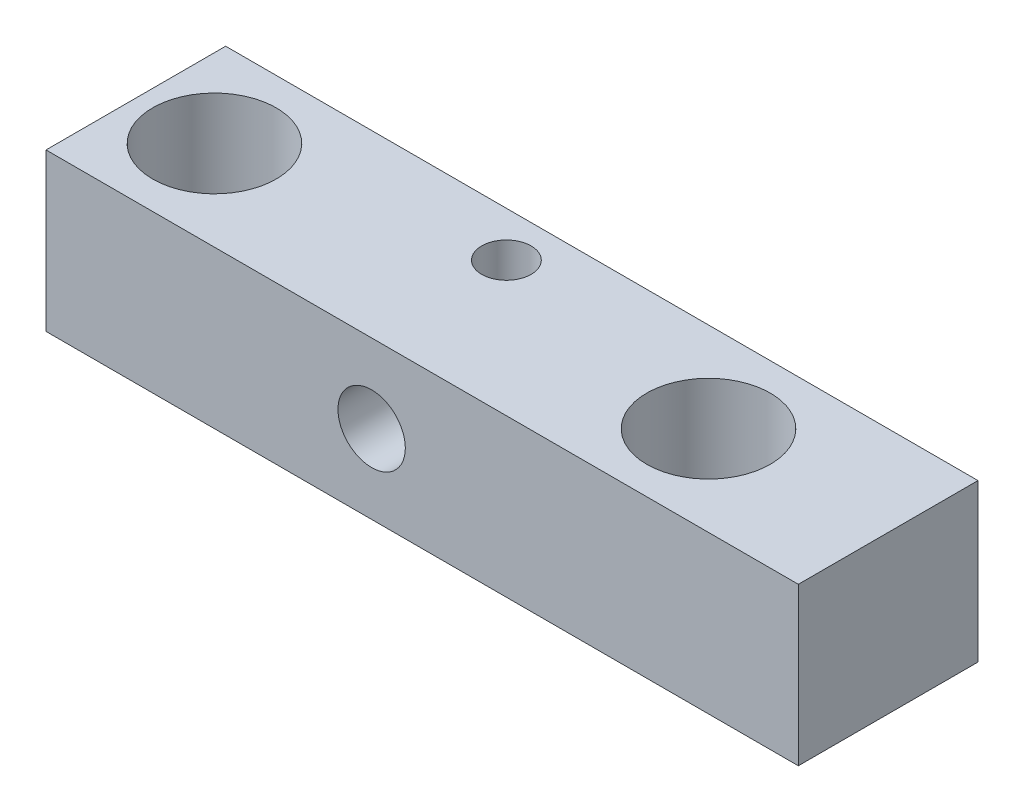
from build123d import *

# Parameters (mm, degrees)
SKETCH_1_W          = 38
SKETCH_1_H          = 8
SKETCH_1_R          = 2.75
SKETCH_1_R_2        = 1.1
EXTRUDE_1_DEPTH     = 7
SKETCH_2_W          = 4.5
SKETCH_2_H          = 7
CUT_EXTRUDE_1_DEPTH = 27.617640313
SKETCH_4_R          = 1.5
CUT_EXTRUDE_2_DEPTH = 6


with BuildPart() as part:
    # 草图1 → 凸台-拉伸1 (new body)
    with BuildSketch(Plane(origin=(0, 0, 0), x_dir=(1, 0, 0), z_dir=(0, 1, 0))):
        with Locations((5.402843602, 4.239336493)):
            Rectangle(SKETCH_1_W, SKETCH_1_H)
        with Locations(Location((-5.597156398, 4.239336493, 0), (0, 0, 270))):
            Circle(SKETCH_1_R, mode=Mode.SUBTRACT)
        with Locations(Location((16.402843602, 4.239336493, 0), (0, 0, 270))):
            Circle(SKETCH_1_R, mode=Mode.SUBTRACT)
        with Locations(Location((5.402843602, 6.239336493, 0), (0, 0, 270))):
            Circle(SKETCH_1_R_2, mode=Mode.SUBTRACT)
    extrude(amount=EXTRUDE_1_DEPTH)

    # 草图2 → 切除-拉伸1 (cut, through all)
    with BuildSketch(Plane.XY.offset(-0.239336493)):
        with Locations((-11.347156398, 3.5)):
            Rectangle(SKETCH_2_W, SKETCH_2_H)
    extrude(amount=-CUT_EXTRUDE_1_DEPTH, mode=Mode.SUBTRACT)

    # 草图4 → 切除-拉伸2 (cut)
    with BuildSketch(Plane.XY.offset(-0.239336493)):
        with Locations((5.402843602, 3.5)):
            Circle(SKETCH_4_R)
    extrude(amount=-CUT_EXTRUDE_2_DEPTH, mode=Mode.SUBTRACT)


solid = part.part
